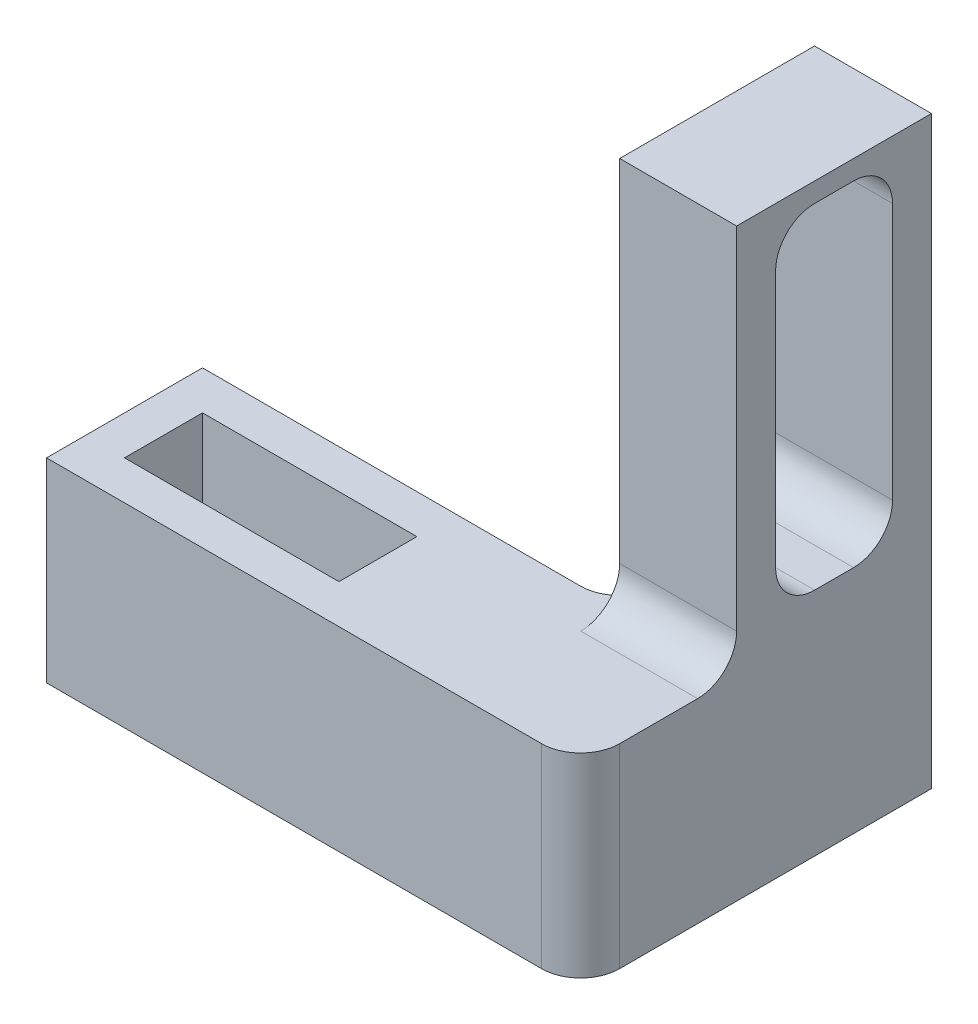
from build123d import *

# Parameters (mm, degrees)
SKETCH1_W           = 7.5
SKETCH1_H           = 4
SKETCH1_W_2         = 5.5
SKETCH1_H_2         = 2
BOSS_EXTRUDE1_DEPTH = 5
SKETCH2_W           = 6.2
SKETCH2_H           = 5
BOSS_EXTRUDE2_DEPTH = 4
SKETCH3_W           = 3
SKETCH3_H           = 5
BOSS_EXTRUDE3_DEPTH = 5
SKETCH4_W           = 3
SKETCH4_H           = 4.997580408
BOSS_EXTRUDE4_DEPTH = 10
SKETCH5_W           = 3
SKETCH5_H           = 8.589941049
CUT_EXTRUDE1_DEPTH  = 10
FILLET1_R           = 1
FILLET2_R           = 1
FILLET3_R           = 1
SKETCH6_W           = 10.7
SKETCH6_H           = 1.997580408
CUT_EXTRUDE2_DEPTH  = 10
FILLET4_R           = 1
FILLET5_R           = 1
FILLET6_R           = 1
FILLET7_R           = 1


with BuildPart() as part:
    # Sketch1 → Boss-Extrude1 (new body)
    with BuildSketch(Plane(origin=(0, 0, 0), x_dir=(1, 0, 0), z_dir=(0, 1, 0))):
        with Locations((0.236475933, 2.906991941)):
            Rectangle(SKETCH1_W, SKETCH1_H)
        with Locations((0.236475933, 2.906991941)):
            Rectangle(SKETCH1_W_2, SKETCH1_H_2, mode=Mode.SUBTRACT)
    extrude(amount=BOSS_EXTRUDE1_DEPTH)

    # Sketch2 → Boss-Extrude2 (add)
    with BuildSketch(Plane(origin=(0, 0, -4.906991941), x_dir=(-1, 0, 0), z_dir=(0, 0, -1))):
        with Locations((-7.086475933, 2.5)):
            Rectangle(SKETCH2_W, SKETCH2_H)
    extrude(amount=-BOSS_EXTRUDE2_DEPTH)

    # Sketch3 → Boss-Extrude3 (add)
    with BuildSketch(Plane(origin=(0, 0, -4.906991941), x_dir=(-1, 0, 0), z_dir=(0, 0, -1))):
        with Locations((-8.686475933, 2.5)):
            Rectangle(SKETCH3_W, SKETCH3_H)
    extrude(amount=BOSS_EXTRUDE3_DEPTH)

    # Sketch4 → Boss-Extrude4 (add)
    with BuildSketch(Plane(origin=(0, 5, 0), x_dir=(1, 0, 0), z_dir=(0, 1, 0))):
        with Locations((8.686475933, 7.408201737)):
            Rectangle(SKETCH4_W, SKETCH4_H)
    extrude(amount=BOSS_EXTRUDE4_DEPTH)

    # Sketch5 → Cut-Extrude1 (cut)
    with BuildSketch(Plane(origin=(10.186475933, 0, 0), x_dir=(0, 0, -1), z_dir=(1, 0, 0))):
        with Locations((7.409411533, 10.205029476)):
            Rectangle(SKETCH5_W, SKETCH5_H)
    extrude(amount=-CUT_EXTRUDE1_DEPTH, mode=Mode.SUBTRACT)

    # Fillet1
    fillet1_edges = [part.edges().sort_by_distance(p)[0] for p in [
        (8.686475933, 5, -4.909411533),
    ]]
    fillet(fillet1_edges, radius=FILLET1_R)

    # Fillet2
    fillet2_edges = [part.edges().sort_by_distance(p)[0] for p in [
        (10.186475933, 2.5, -0.906991941),
    ]]
    fillet(fillet2_edges, radius=FILLET2_R)

    # Fillet3
    fillet3_edges = [part.edges().sort_by_distance(p)[0] for p in [
        (7.186475933, 2.965238926, -4.906991941),
    ]]
    fillet(fillet3_edges, radius=FILLET3_R)

    # Sketch6 → Cut-Extrude2 (cut)
    with BuildSketch(Plane(origin=(0, 15, 0), x_dir=(1, 0, 0), z_dir=(0, 1, 0))):
        with Locations((1.836475933, 4.908201737)):
            Rectangle(SKETCH6_W, SKETCH6_H)
    extrude(amount=-CUT_EXTRUDE2_DEPTH, mode=Mode.SUBTRACT)

    # Fillet4
    fillet4_edges = [part.edges().sort_by_distance(p)[0] for p in [
        (8.686475933, 5.910058951, -8.909411533),
    ]]
    fillet(fillet4_edges, radius=FILLET4_R)

    # Fillet5
    fillet5_edges = [part.edges().sort_by_distance(p)[0] for p in [
        (8.686475933, 5.910058951, -5.909411533),
    ]]
    fillet(fillet5_edges, radius=FILLET5_R)

    # Fillet6
    fillet6_edges = [part.edges().sort_by_distance(p)[0] for p in [
        (8.686475933, 14.5, -5.909411533),
    ]]
    fillet(fillet6_edges, radius=FILLET6_R)

    # Fillet7
    fillet7_edges = [part.edges().sort_by_distance(p)[0] for p in [
        (8.686475933, 14.5, -8.909411533),
    ]]
    fillet(fillet7_edges, radius=FILLET7_R)


solid = part.part
